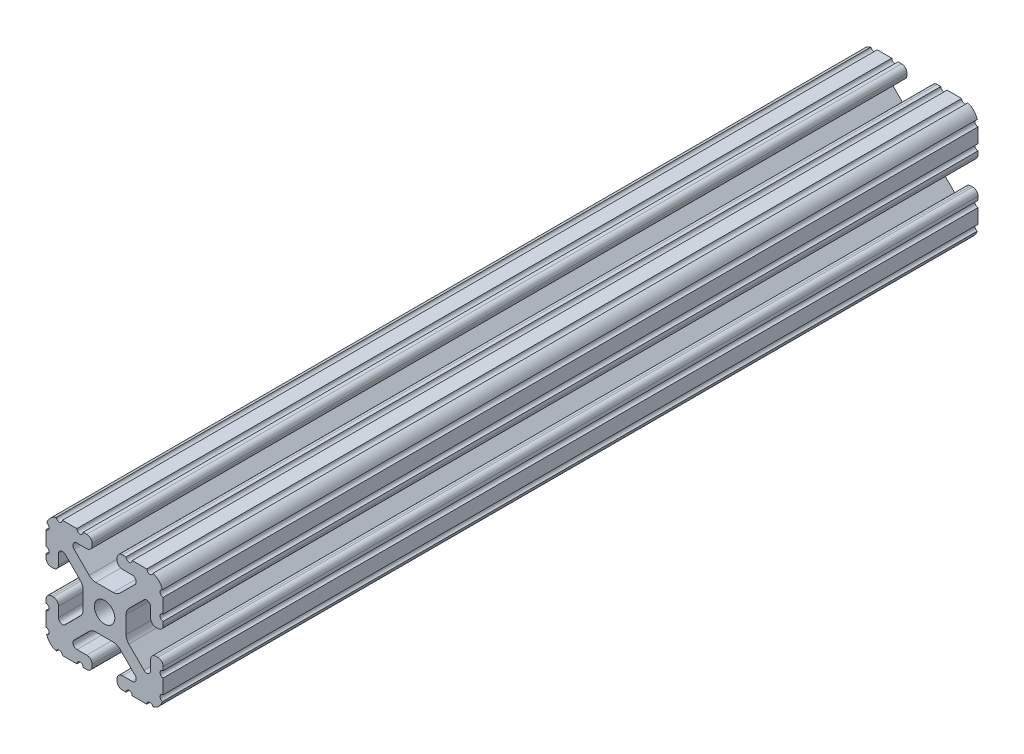
from build123d import *

# Parameters (mm, degrees)
BOSS_EXTRUDE1_DEPTH     = 132.5
CUT_EXTRUDE1_DEPTH      = 136.211149688
CUT_EXTRUDE1_DEPTH_BACK = 136.211149688
SKETCH5_R               = 1.016


with BuildPart() as part:
    # Sketch4 → Boss-Extrude1 (new, symmetric)
    with BuildSketch(Plane.XY):
        with BuildLine():
            Line((5.7912, -19.05), (14.3002, -19.05))
            ThreePointArc((14.3002, -19.05), (17.658815789, -17.658815789), (19.05, -14.3002))
            Line((19.05, -14.3002), (19.05, -5.7912))
            ThreePointArc((19.05, -5.7912), (18.544114832, -4.569885168), (17.3228, -4.064))
            Line((17.3228, -4.064), (16.7132, -4.064))
            ThreePointArc((16.7132, -4.064), (15.491885168, -4.569885168), (14.986, -5.7912))
            Line((14.986, -5.7912), (14.986, -8.996305235))
            ThreePointArc((14.986, -8.996305235), (14.189232738, -10.188751711), (12.782646215, -9.908964256))
            Line((12.782646215, -9.908964256), (7.888897763, -5.015215804))
            ThreePointArc((7.888897763, -5.015215804), (7.219915375, -4.014012907), (6.985, -2.833013566))
            Line((6.985, -2.833013566), (6.985, 0))
            Line((6.985, 0), (3.3274, 0))
            ThreePointArc((3.3274, 0), (2.352827104, -2.352827104), (0, -3.3274))
            Line((0, -3.3274), (0, -6.985))
            Line((0, -6.985), (2.833013566, -6.985))
            ThreePointArc((2.833013566, -6.985), (4.014012907, -7.219915375), (5.015215804, -7.888897763))
            Line((5.015215804, -7.888897763), (9.908964256, -12.782646215))
            ThreePointArc((9.908964256, -12.782646215), (10.188751711, -14.189232738), (8.996305235, -14.986))
            Line((8.996305235, -14.986), (5.7912, -14.986))
            ThreePointArc((5.7912, -14.986), (4.569885168, -15.491885168), (4.064, -16.7132))
            Line((4.064, -16.7132), (4.064, -17.3228))
            ThreePointArc((4.064, -17.3228), (4.569885168, -18.544114832), (5.7912, -19.05))
        make_face()
    extrude(amount=BOSS_EXTRUDE1_DEPTH, both=True)

    # Sketch5 → Cut-Extrude1 (cut, two sides: drawn at the far end of the back side and taken through both)
    with BuildSketch(Plane.XY.offset(-CUT_EXTRUDE1_DEPTH_BACK)):
        with Locations((14.739477062, -19.05)):
            Circle(SKETCH5_R)
        with Locations((7.980305235, -19.05)):
            Circle(SKETCH5_R)
        with Locations((19.05, -14.739477062)):
            Circle(SKETCH5_R)
        with Locations((19.05, -7.980305235)):
            Circle(SKETCH5_R)
    extrude(amount=CUT_EXTRUDE1_DEPTH + CUT_EXTRUDE1_DEPTH_BACK, mode=Mode.SUBTRACT)

    # Mirror1: part across plane


with BuildPart() as part_1:
    add(part.part)
    add(part.part.mirror(Plane(origin=(0, 0, 0), x_dir=(0, 0, 1), z_dir=(1, 0, 0))))

    # Mirror2: part across plane


with BuildPart() as part_2:
    add(part_1.part)
    add(part_1.part.mirror(Plane.ZX))


solid = part_2.part
